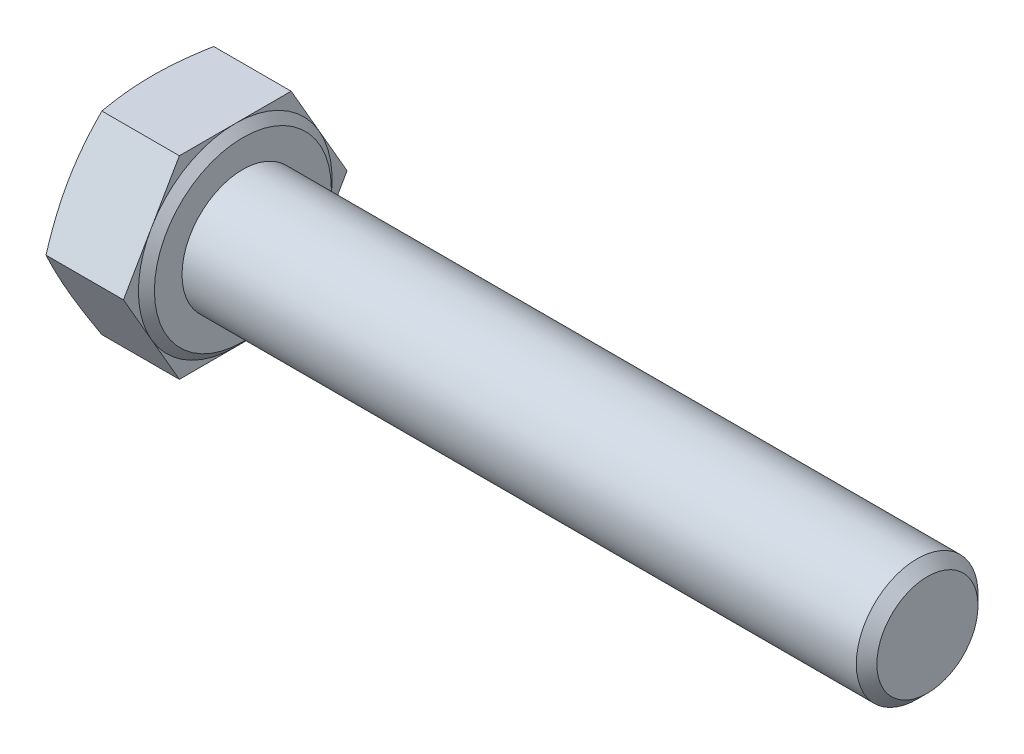
from build123d import *

# Parameters (mm, degrees)
BASEHEAD_DEPTH = 5.45
SKETCH3_R      = 4
BASEBODY_DEPTH = 45
CHAMFER1_SIZE  = 0.6765


with BuildPart() as part:
    # Sketch-BaseHead → BaseHead (new body)
    with BuildSketch(Plane(origin=(0, 0, 0), x_dir=(0, 0, -1), z_dir=(1, 0, 0))):
        Polygon((7.349668927, 0), (3.674834463, 6.365), (-3.674834463, 6.365), (-7.349668927, 0), (-3.674834463, -6.365), (3.674834463, -6.365), align=None)
    extrude(amount=BASEHEAD_DEPTH)

    # Sketch4 → HeadChamfer (revolve, cut)
    with BuildSketch(Plane(origin=(-0.264637255, 0, 5.916896391), x_dir=(0, 0, -1), z_dir=(0, 1, 0))):
        Polygon((13.266565318, -0.264637255), (12.281896391, -0.264637255), (13.266565318, -0.623027435), align=None)
    revolve(axis=Axis((-4.001564945, 0, 0), (1, 0, 0)), mode=Mode.SUBTRACT)

    # Sketch1 → Revolve1 (revolve)
    with BuildSketch(Plane.XY, mode=Mode.PRIVATE) as revolve1_sk:
        Polygon((5.45, 0), (5.95, 0), (5.95, -5.815), (5.45, -6.365), align=None)
    revolve(revolve1_sk.sketch.rotate(Axis((-4.001564945, 0, 0), (1, 0, 0)), 270), axis=Axis((-4.001564945, 0, 0), (1, 0, 0)))

    # Sketch3 → BaseBody (add)
    with BuildSketch(Plane(origin=(5.95, 0, 0), x_dir=(0, 0, -1), z_dir=(1, 0, 0))):
        with Locations(Location((0, 0, 0), (0, 0, 180))):
            Circle(SKETCH3_R)
    extrude(amount=BASEBODY_DEPTH)

    # Chamfer1
    chamfer1_edges = [part.edges().sort_by_distance(p)[0] for p in [
        (50.95, 0, -4),
    ]]
    chamfer(chamfer1_edges, length=CHAMFER1_SIZE)


solid = part.part
